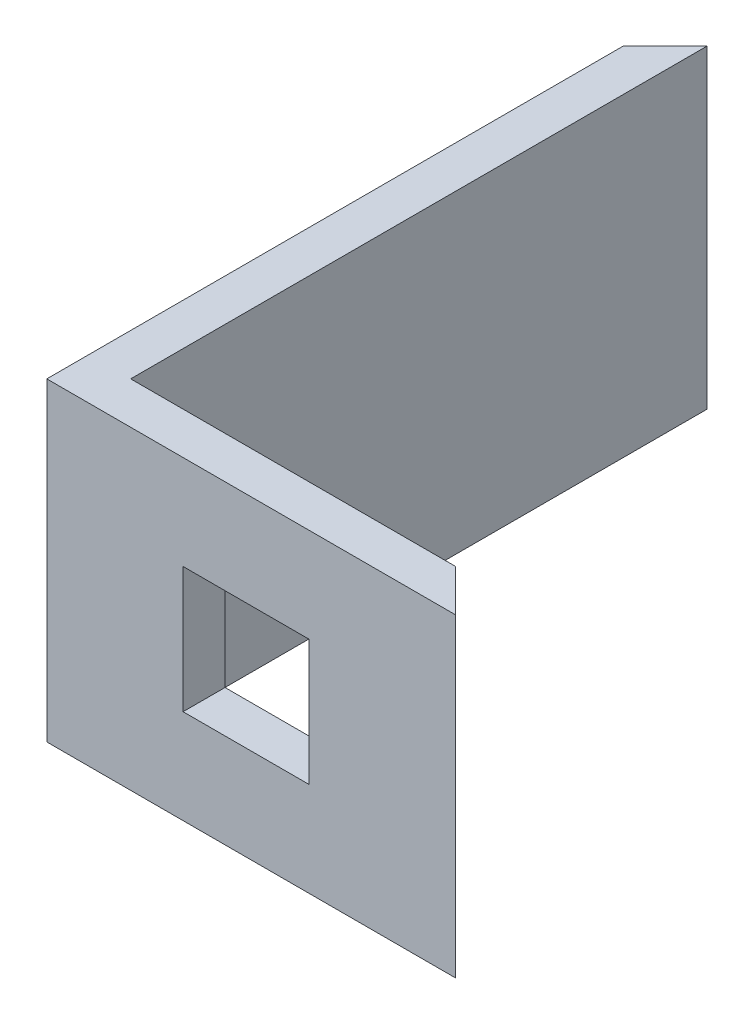
from build123d import *

# Parameters (mm, degrees)
EXTRUDE_1_DEPTH     = 15
SKETCH_2_W          = 6
SKETCH_2_H          = 6
CUT_EXTRUDE_1_DEPTH = 38.436613095


with BuildPart() as part:
    # Эскиз1 → Бобышка-Вытянуть1 (new body)
    with BuildSketch(Plane(origin=(0, 0, 0), x_dir=(1, 0, 0), z_dir=(0, 1, 0))):
        Polygon((-2, 25.5), (-2, -2), (17.5, -2), (15.5, 0), (0, 0), (0, 27.5), align=None)
    extrude(amount=EXTRUDE_1_DEPTH)

    # Эскиз2 → Вырез-Вытянуть1 (cut, through all)
    with BuildSketch(Plane.XY.offset(2)):
        with Locations((7.5, 7.5)):
            Rectangle(SKETCH_2_W, SKETCH_2_H)
    extrude(amount=-CUT_EXTRUDE_1_DEPTH, mode=Mode.SUBTRACT)


solid = part.part
